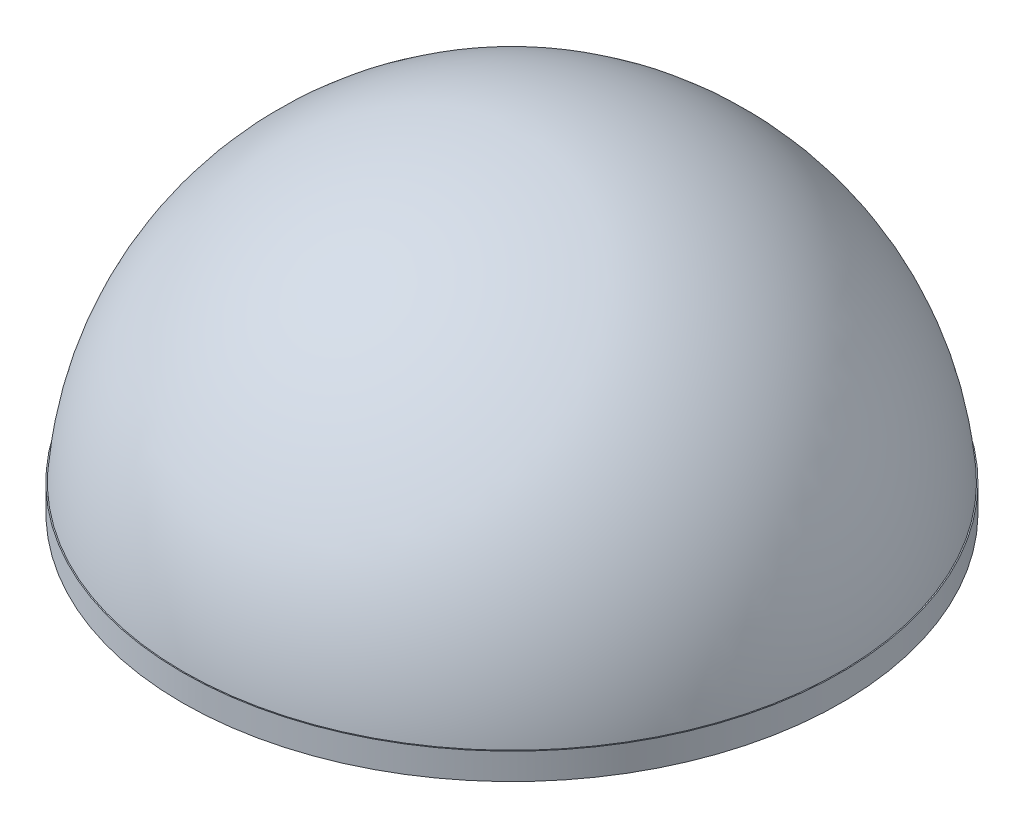
from build123d import *

# Parameters (mm, degrees)
REVOLVE1_ANGLE      = 180
SHELL1_T            = -1.27
SKETCH6_R           = 31.75
SKETCH6_R_2         = 30.48
BOSS_EXTRUDE1_DEPTH = 2.54


with BuildPart() as part:
    # Sketch1 → Revolve1 (revolve)
    with BuildSketch(Plane(origin=(0, 0, 0), x_dir=(1, 0, 0), z_dir=(0, 1, 0))):
        with BuildLine():
            Line((0, 31.75), (0, -31.75))
            ThreePointArc((0, -31.75), (31.75, 0), (0, 31.75))
        make_face()
    revolve(axis=Axis((0, 0, -31.75), (0, 0, 1)), revolution_arc=REVOLVE1_ANGLE)

    # Shell1
    shell1_openings = [part.faces().sort_by_distance(p)[0] for p in [
        (0, 0, 0),
    ]]
    offset(amount=SHELL1_T, openings=shell1_openings)

    # Sketch6 → Boss-Extrude1 (add)
    with BuildSketch(Plane(origin=(0, 0, 0), x_dir=(1, 0, 0), z_dir=(0, 1, 0))):
        with Locations(Location((0, 0, 0), (0, 0, 270))):
            Circle(SKETCH6_R)
        Circle(SKETCH6_R_2, mode=Mode.SUBTRACT)
    extrude(amount=BOSS_EXTRUDE1_DEPTH)


solid = part.part
